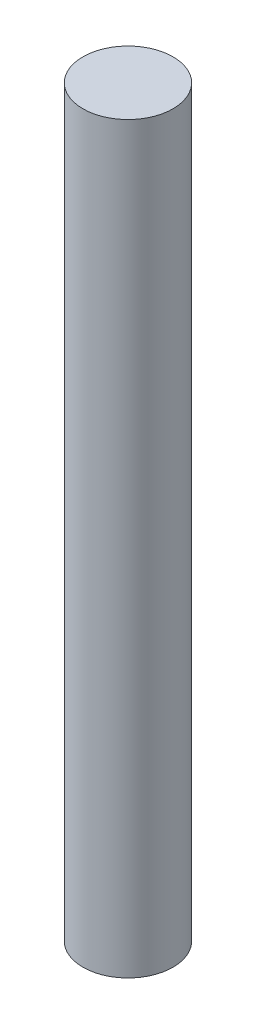
from build123d import *

# Parameters (mm, degrees)
SKETCH1_R           = 2
BOSS_EXTRUDE1_DEPTH = 33


with BuildPart() as part:
    # Sketch1 → Boss-Extrude1 (new body)
    with BuildSketch(Plane(origin=(0, 0, 0), x_dir=(1, 0, 0), z_dir=(0, 1, 0))):
        with Locations(Location((0, 0, 0), (0, 0, 270))):
            Circle(SKETCH1_R)
    extrude(amount=BOSS_EXTRUDE1_DEPTH)


solid = part.part
